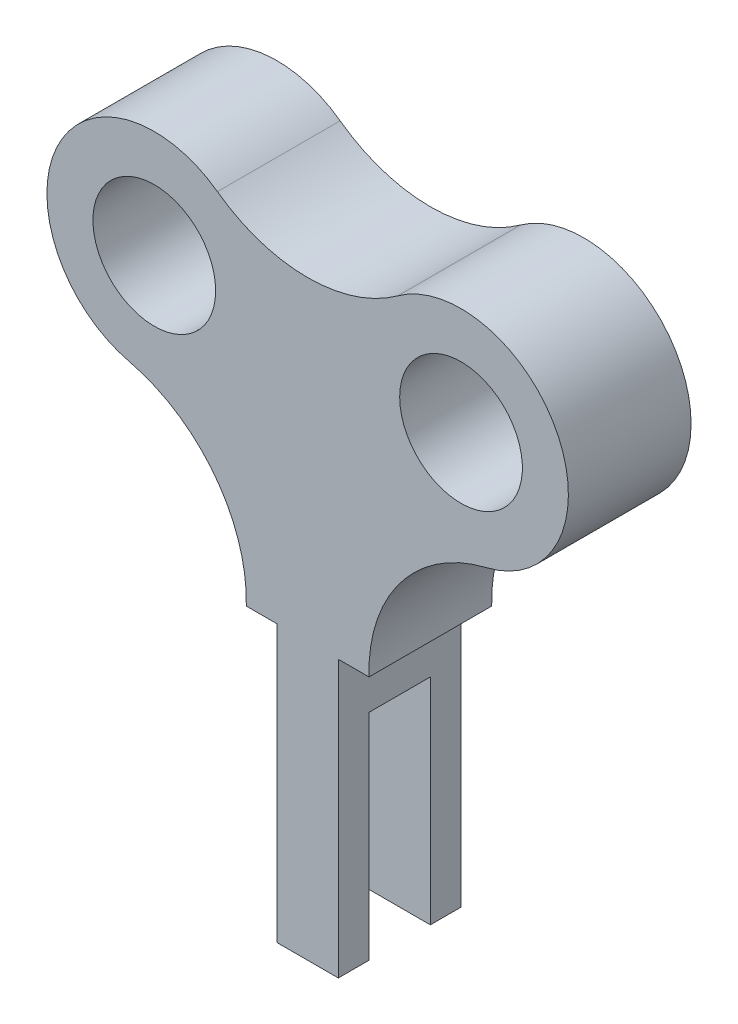
from build123d import *

# Parameters (mm, degrees)
IZIM1_R                     = 10
Y_KSEKLIK_EKSTR_ZYON1_DEPTH = 20
IZIM3_W                     = 10
IZIM3_H                     = 35
KES_EKSTR_ZYON1_DEPTH       = 10


with BuildPart() as part:
    # Çizim1 → Yükseklik-Ekstrüzyon1 (new body)
    with BuildSketch(Plane.XY):
        with BuildLine():
            Line((-10, -8.115065243), (-5, -8.115065243))
            Line((-5, -8.115065243), (-5, -53.115065243))
            Line((-5, -53.115065243), (5, -53.115065243))
            Line((5, -53.115065243), (5, -8.115065243))
            Line((5, -8.115065243), (10, -8.115065243))
            ThreePointArc((10, -8.115065243), (15.132819854, 7.763816786), (29.113715132, 16.875309605))
            ThreePointArc((29.113715132, 16.875309605), (40.884337762, 41.229171535), (14.705882353, 48.037006756))
            ThreePointArc((14.705882353, 48.037006756), (0, 43.254252469), (-14.705882353, 48.037006756))
            ThreePointArc((-14.705882353, 48.037006756), (-40.884337762, 41.229171535), (-29.113715132, 16.875309605))
            ThreePointArc((-29.113715132, 16.875309605), (-15.132819854, 7.763816786), (-10, -8.115065243))
        make_face()
        with Locations((-25, 33.884934757)):
            Circle(IZIM1_R, mode=Mode.SUBTRACT)
        with Locations(Location((25, 33.884934757, 0), (0, 0, 180))):
            Circle(IZIM1_R, mode=Mode.SUBTRACT)
    extrude(amount=Y_KSEKLIK_EKSTR_ZYON1_DEPTH)

    # Çizim3 → Kes-Ekstrüzyon1 (cut)
    with BuildSketch(Plane(origin=(5, 0, 0), x_dir=(0, 0, -1), z_dir=(1, 0, 0))):
        with Locations((-10, -35.615065243)):
            Rectangle(IZIM3_W, IZIM3_H)
    extrude(amount=-KES_EKSTR_ZYON1_DEPTH, mode=Mode.SUBTRACT)


solid = part.part
